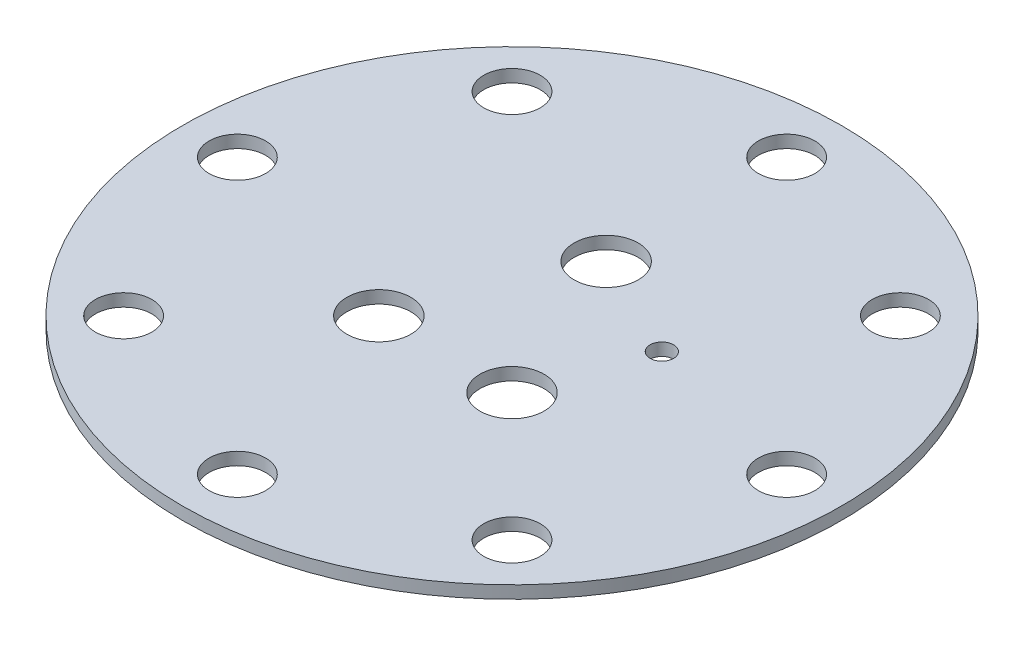
from build123d import *

# Parameters (mm, degrees)
SKETCH3_R           = 105
SKETCH3_R_2         = 10.2
SKETCH3_R_3         = 9
SKETCH3_R_4         = 3.75
BOSS_EXTRUDE1_DEPTH = 4


with BuildPart() as part:
    # Sketch3 → Boss-Extrude1 (new body)
    with BuildSketch(Plane(origin=(0, 0, 0), x_dir=(1, 0, 0), z_dir=(0, 1, 0))):
        with Locations(Location((0, 0, 0), (0, 0, 270))):
            Circle(SKETCH3_R)
        with Locations(Location((0, 30, 0), (0, 0, 270))):
            Circle(SKETCH3_R_2, mode=Mode.SUBTRACT)
        with Locations(Location((61.871843354, 61.871843354, 0), (0, 0, 270))):
            Circle(SKETCH3_R_3, mode=Mode.SUBTRACT)
        with Locations(Location((0, 87.5, 0), (0, 0, 270))):
            Circle(SKETCH3_R_3, mode=Mode.SUBTRACT)
        with Locations(Location((-61.871843354, 61.871843354, 0), (0, 0, 270))):
            Circle(SKETCH3_R_3, mode=Mode.SUBTRACT)
        with Locations(Location((-87.5, 0, 0), (0, 0, 270))):
            Circle(SKETCH3_R_3, mode=Mode.SUBTRACT)
        with Locations(Location((-61.871843354, -61.871843354, 0), (0, 0, 270))):
            Circle(SKETCH3_R_3, mode=Mode.SUBTRACT)
        with Locations(Location((0, -87.5, 0), (0, 0, 270))):
            Circle(SKETCH3_R_3, mode=Mode.SUBTRACT)
        with Locations(Location((61.871843354, -61.871843354, 0), (0, 0, 270))):
            Circle(SKETCH3_R_3, mode=Mode.SUBTRACT)
        with Locations(Location((87.5, 0, 0), (0, 0, 270))):
            Circle(SKETCH3_R_3, mode=Mode.SUBTRACT)
        with Locations(Location((-21.213203436, -21.213203436, 0), (0, 0, 270))):
            Circle(SKETCH3_R_2, mode=Mode.SUBTRACT)
        with Locations(Location((33.760092737, 13.983888279, 0), (0, 0, 270))):
            Circle(SKETCH3_R_4, mode=Mode.SUBTRACT)
        with Locations(Location((21.213203436, -21.213203436, 0), (0, 0, 270))):
            Circle(SKETCH3_R_2, mode=Mode.SUBTRACT)
    extrude(amount=BOSS_EXTRUDE1_DEPTH)


solid = part.part
